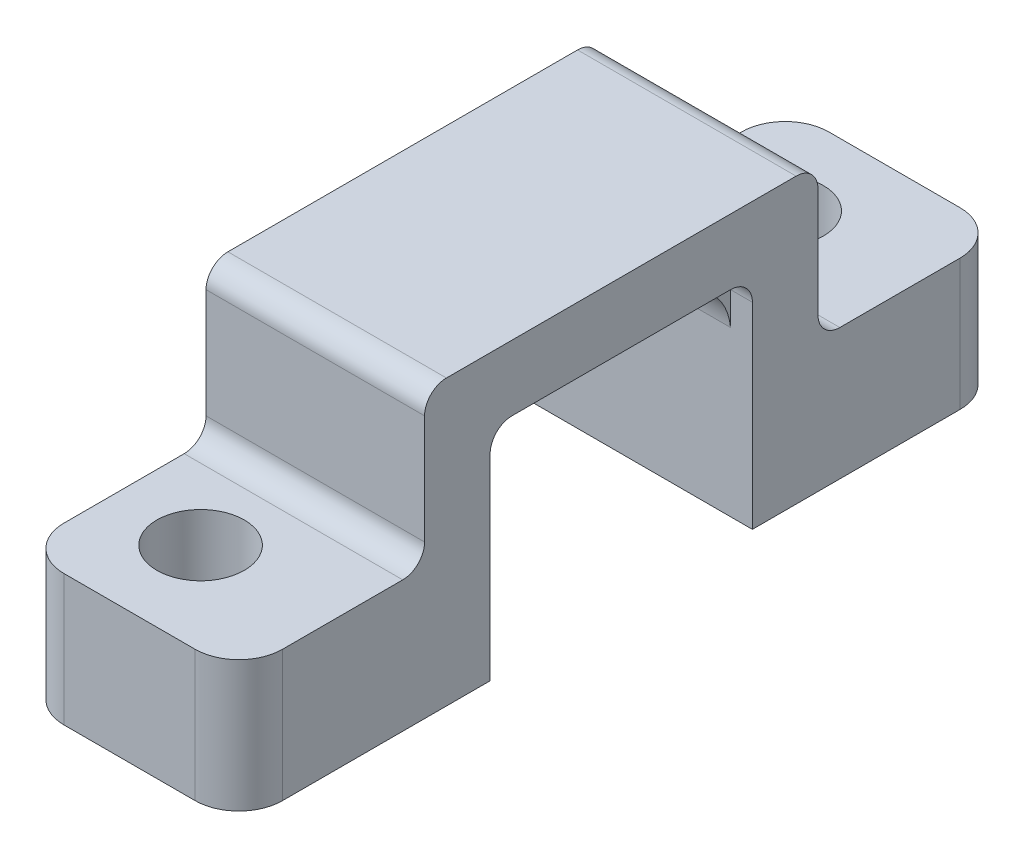
from build123d import *

# Parameters (mm, degrees)
ESBO_O1_W                      = 18.5
ESBO_O1_H                      = 13
RESSALTO_EXTRUS_O1_DEPTH       = 8
ESBO_O2_W                      = 8.5
ESBO_O2_H                      = 10
CORTE_EXTRUS_O1_DEPTH          = 21.377683872
ESBO_O3_W                      = 10
ESBO_O3_H                      = 3
RESSALTO_EXTRUS_O2_DEPTH       = 20
ESBO_O4_W                      = 10
ESBO_O4_H                      = 8
RESSALTO_EXTRUS_O3_DEPTH       = 10
ESBO_O5_W                      = 8
ESBO_O5_H                      = 3
RESSALTO_EXTRUS_O4_DEPTH       = 8.5
ESBO_O6_W                      = 5
ESBO_O6_H                      = 8
CORTE_EXTRUS_O2_DEPTH          = 22.563858653
ESBO_O7_W                      = 5
ESBO_O7_H                      = 8
CORTE_EXTRUS_O3_DEPTH          = 22.563858653
FURO_DE_DI_METRO_4_0_4_1_D     = 4
FURO_DE_DI_METRO_4_0_4_1_DEPTH = 13
FURO_DE_DI_METRO_4_0_4_2_D     = 4
FILETE1_R                      = 1
FILETE2_R                      = 2
RESSALTO_EXTRUS_O5_DEPTH       = 4
ESBO_O16_W                     = 10.570066626
ESBO_O16_H                     = 8.435311821
CORTE_EXTRUS_O4_DEPTH          = 10
ESBO_O17_W                     = 5
ESBO_O17_H                     = 6
CORTE_EXTRUS_O5_DEPTH          = 10
ESBO_O18_W                     = 5
ESBO_O18_H                     = 7.112668327
CORTE_EXTRUS_O6_DEPTH          = 22
ESBO_O19_W                     = 8.5
ESBO_O19_H                     = 3
CORTE_EXTRUS_O7_DEPTH          = 22
ESBO_O28_R                     = 2
RESSALTO_EXTRUS_O9_DEPTH       = 13
ESBO_O29_W                     = 8.5
ESBO_O29_H                     = 7
CORTE_EXTRUS_O10_DEPTH         = 25
FILETE3_R                      = 1


with BuildPart() as part:
    # Esboço1 → Ressalto-extrusão1 (new body)
    with BuildSketch(Plane(origin=(0, 0, 6), x_dir=(-1, 0, 0), z_dir=(0, 0, -1))):
        with Locations((4.25, 6.5)):
            Rectangle(ESBO_O1_W, ESBO_O1_H)
    extrude(amount=-RESSALTO_EXTRUS_O1_DEPTH)

    # Esboço2 → Corte-extrusão1 (cut, through all)
    with BuildSketch(Plane.XY.offset(14)):
        with Locations((-9.25, 8)):
            Rectangle(ESBO_O2_W, ESBO_O2_H)
    extrude(amount=-CORTE_EXTRUS_O1_DEPTH, mode=Mode.SUBTRACT)

    # Esboço3 → Ressalto-extrusão2 (add)
    with BuildSketch(Plane(origin=(0, 0, 6), x_dir=(-1, 0, 0), z_dir=(0, 0, -1))):
        with Locations((0, 11.5)):
            Rectangle(ESBO_O3_W, ESBO_O3_H)
    extrude(amount=RESSALTO_EXTRUS_O2_DEPTH)

    # Esboço4 → Ressalto-extrusão3 (add)
    with BuildSketch(Plane.XZ.offset(-10)):
        with Locations((0, -10)):
            Rectangle(ESBO_O4_W, ESBO_O4_H)
    extrude(amount=RESSALTO_EXTRUS_O3_DEPTH)

    # Esboço5 → Ressalto-extrusão4 (add)
    with BuildSketch(Plane.ZY.offset(5)):
        with Locations((-10, 1.5)):
            Rectangle(ESBO_O5_W, ESBO_O5_H)
    extrude(amount=RESSALTO_EXTRUS_O4_DEPTH)

    # Esboço6 → Corte-extrusão2 (cut, through all)
    with BuildSketch(Plane.ZY.offset(5)):
        with Locations((-11.5, 9)):
            Rectangle(ESBO_O6_W, ESBO_O6_H)
    extrude(amount=-CORTE_EXTRUS_O2_DEPTH, mode=Mode.SUBTRACT)

    # Esboço7 → Corte-extrusão3 (cut, through all)
    with BuildSketch(Plane.ZY.offset(5)):
        with Locations((11.5, 9)):
            Rectangle(ESBO_O7_W, ESBO_O7_H)
    extrude(amount=-CORTE_EXTRUS_O3_DEPTH, mode=Mode.SUBTRACT)

    # Furo de diâmetro Ø4.0 (4)1
    with Locations(Plane(origin=(0, 0, 0), x_dir=(-1, 0, 0), z_dir=(0, -1, 0))):
        with Locations((9.25, 10)):
            Hole(FURO_DE_DI_METRO_4_0_4_1_D / 2, depth=FURO_DE_DI_METRO_4_0_4_1_DEPTH)

    # Furo de diâmetro Ø4.0 (4)2 (through all)
    with Locations(Plane(origin=(0, 3, 0), x_dir=(1, 0, 0), z_dir=(0, 1, 0))):
        with Locations((-9.25, -10)):
            Hole(FURO_DE_DI_METRO_4_0_4_2_D / 2)

    # Filete1
    filete1_edges = [part.edges().sort_by_distance(p)[0] for p in [
        (0, 10, 6),
        (0, 10, -6),
        (0, 13, -9),
        (0, 5, -9),
        (0, 13, 9),
        (0, 5, 9),
    ]]
    fillet(filete1_edges, radius=FILETE1_R)

    # Filete2
    filete2_edges = [part.edges().sort_by_distance(p)[0] for p in [
        (-13.5, 1.5, 14),
        (-13.5, 1.5, 6),
        (-13.5, 1.5, -14),
        (-13.5, 1.5, -6),
    ]]
    fillet(filete2_edges, radius=FILETE2_R)

    # Esboço15 → Ressalto-extrusão5 (add)
    with BuildSketch(Plane(origin=(4, 0, 0), x_dir=(0, 0, -1), z_dir=(1, 0, 0))):
        with BuildLine():
            Line((-6, 10), (-6, 7.5))
            ThreePointArc((-6, 7.5), (-5.18496543, 9.208933408), (-3.464806021, 10))
            Line((-3.464806021, 10), (-6, 10))
        make_face()
        with BuildLine():
            ThreePointArc((3.464806021, 10), (5.18496543, 9.208933408), (6, 7.5))
            Line((6, 7.5), (6, 10))
            Line((6, 10), (3.464806021, 10))
        make_face()
    extrude(amount=-RESSALTO_EXTRUS_O5_DEPTH)

    # Esboço16 → Corte-extrusão4 (cut)
    with BuildSketch(Plane(origin=(0, 3, 0), x_dir=(1, 0, 0), z_dir=(0, 1, 0))):
        with Locations((-10.285033313, -10.21765591)):
            Rectangle(ESBO_O16_W, ESBO_O16_H)
    extrude(amount=-CORTE_EXTRUS_O4_DEPTH, mode=Mode.SUBTRACT)

    # Esboço17 → Corte-extrusão5 (cut)
    with BuildSketch(Plane(origin=(5, 0, 0), x_dir=(0, 0, -1), z_dir=(1, 0, 0))):
        with Locations((-11.5, 3)):
            Rectangle(ESBO_O17_W, ESBO_O17_H)
    extrude(amount=-CORTE_EXTRUS_O5_DEPTH, mode=Mode.SUBTRACT)

    # Esboço18 → Corte-extrusão6 (cut)
    with BuildSketch(Plane(origin=(5, 0, 0), x_dir=(0, 0, -1), z_dir=(1, 0, 0))):
        with Locations((11.5, 3.556334164)):
            Rectangle(ESBO_O18_W, ESBO_O18_H)
    extrude(amount=-CORTE_EXTRUS_O6_DEPTH, mode=Mode.SUBTRACT)

    # Esboço19 → Corte-extrusão7 (cut)
    with BuildSketch(Plane.XY.offset(-6)):
        with Locations((-9.25, 1.5)):
            Rectangle(ESBO_O19_W, ESBO_O19_H)
    extrude(amount=-CORTE_EXTRUS_O7_DEPTH, mode=Mode.SUBTRACT)

    # Esboço28 → Ressalto-extrusão9 (add, through all)
    # profile 1 of 2: a face of its own
    with BuildSketch(Plane(origin=(0, 13, 0), x_dir=(1, 0, 0), z_dir=(0, 1, 0))):
        with BuildLine():
            Line((-5, -9), (5, -9))
            Line((5, -9), (5, -15.5))
            ThreePointArc((5, -15.5), (4.414213562, -16.914213562), (3, -17.5))
            Line((3, -17.5), (-3, -17.5))
            ThreePointArc((-3, -17.5), (-4.414213562, -16.914213562), (-5, -15.5))
            Line((-5, -15.5), (-5, -9))
        make_face()
        with Locations(Location((-1, -13.25, 0), (0, 0, 270))):
            Circle(ESBO_O28_R, mode=Mode.SUBTRACT)
    # profile 2 of 2: a face of its own
    with BuildSketch(Plane(origin=(0, 13, 0), x_dir=(1, 0, 0), z_dir=(0, 1, 0))):
        with BuildLine():
            Line((3, 17.5), (-3, 17.5))
            ThreePointArc((-3, 17.5), (-4.414213562, 16.914213562), (-5, 15.5))
            Line((-5, 15.5), (-5, 9))
            Line((-5, 9), (5, 9))
            Line((5, 9), (5, 15.5))
            ThreePointArc((5, 15.5), (4.414213562, 16.914213562), (3, 17.5))
        make_face()
        with Locations(Location((-1, 13.25, 0), (0, 0, 90))):
            Circle(ESBO_O28_R, mode=Mode.SUBTRACT)
    extrude(amount=-RESSALTO_EXTRUS_O9_DEPTH)

    # Esboço29 → Corte-extrusão10 (cut)
    with BuildSketch(Plane.ZY.offset(5)):
        with Locations((-13.25, 9.5)):
            Rectangle(ESBO_O29_W, ESBO_O29_H)
        with Locations((13.25, 9.5)):
            Rectangle(ESBO_O29_W, ESBO_O29_H)
    extrude(amount=-CORTE_EXTRUS_O10_DEPTH, mode=Mode.SUBTRACT)

    # Filete3
    filete3_edges = [part.edges().sort_by_distance(p)[0] for p in [
        (0, 6, -9),
        (0, 6, 9),
    ]]
    fillet(filete3_edges, radius=FILETE3_R)


solid = part.part
